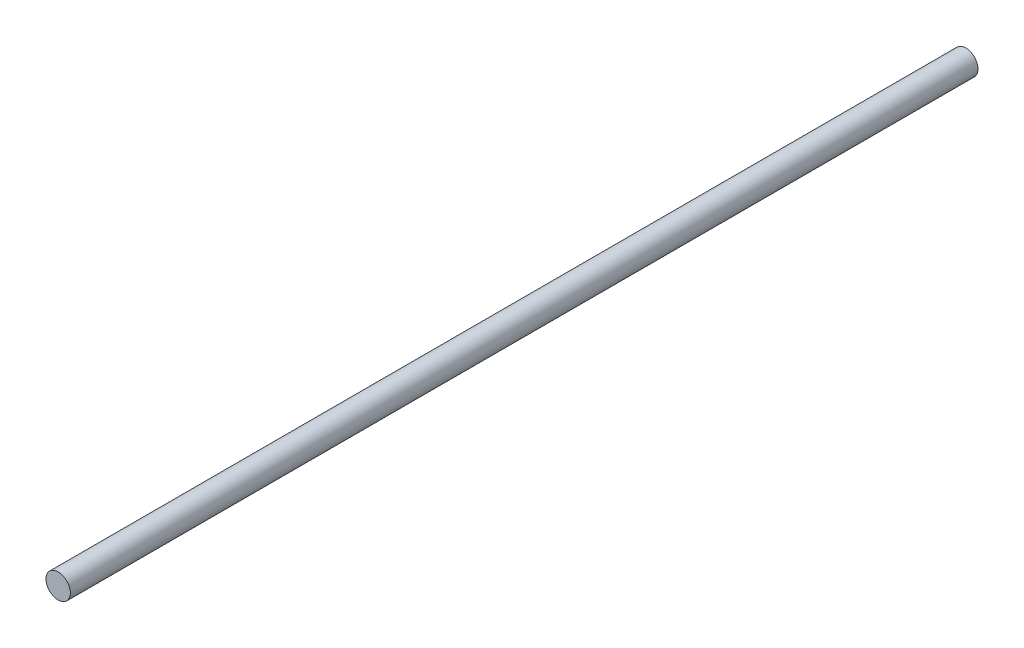
from build123d import *

# Parameters (mm, degrees)
SKETCH1_R           = 12.7
BOSS_EXTRUDE1_DEPTH = 944.88


with BuildPart() as part:
    # Sketch1 → Boss-Extrude1 (new body)
    with BuildSketch(Plane.XY):
        Circle(SKETCH1_R)
    extrude(amount=BOSS_EXTRUDE1_DEPTH)


solid = part.part
